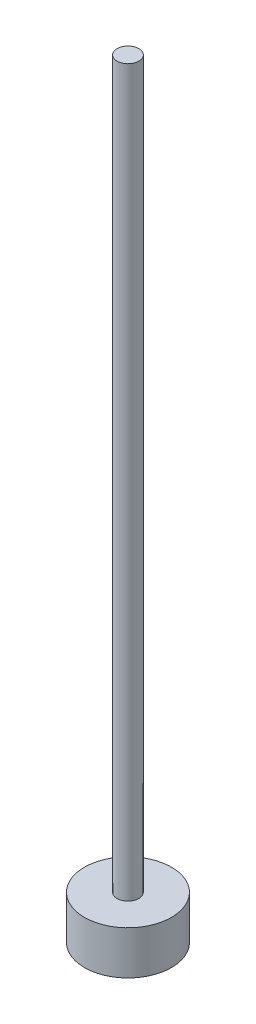
from build123d import *

# Parameters (mm, degrees)
SKETCH1_R           = 3
BOSS_EXTRUDE1_DEPTH = 3
SKETCH2_R           = 0.75
BOSS_EXTRUDE2_DEPTH = 50


with BuildPart() as part:
    # Sketch1 → Boss-Extrude1 (new body)
    with BuildSketch(Plane(origin=(0, 0, 0), x_dir=(1, 0, 0), z_dir=(0, 1, 0))):
        with Locations(Location((0, 0, 0), (0, 0, 270))):
            Circle(SKETCH1_R)
    extrude(amount=BOSS_EXTRUDE1_DEPTH)

    # Sketch2 → Boss-Extrude2 (add)
    with BuildSketch(Plane(origin=(0, 3, 0), x_dir=(1, 0, 0), z_dir=(0, 1, 0))):
        with Locations(Location((0, 0, 0), (0, 0, 270))):
            Circle(SKETCH2_R)
    extrude(amount=BOSS_EXTRUDE2_DEPTH)


solid = part.part
